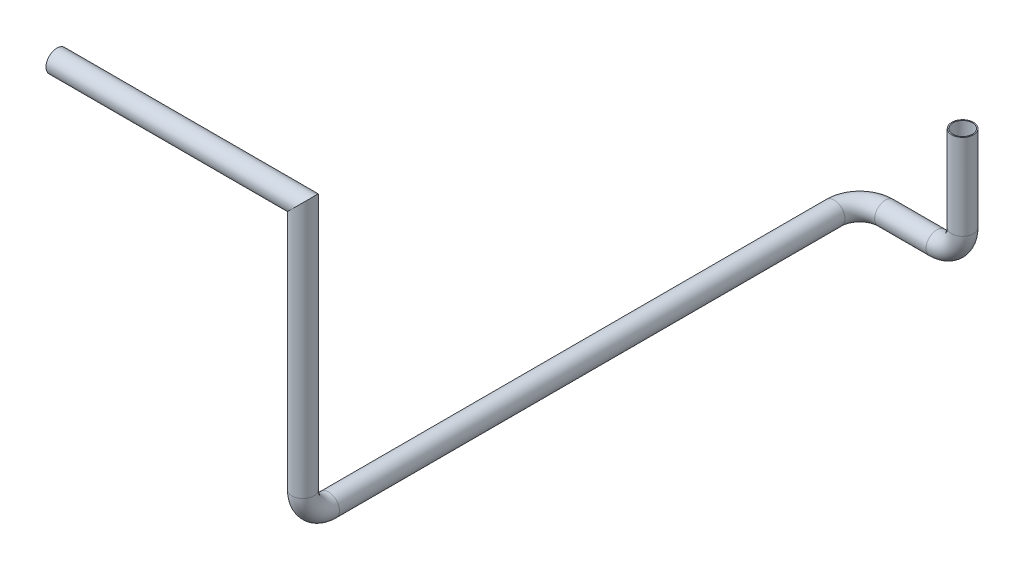
from build123d import *

# Parameters (mm, degrees)
CROQUIS1_R              = 12.7
CROQUIS1_R_2            = 11.5
SALIENTE_EXTRUIR1_DEPTH = 10
CROQUIS2_R              = 12.7
CROQUIS2_R_2            = 11.5


with BuildPart() as part:
    # Croquis1 → Saliente-Extruir1 (new body)
    with BuildSketch(Plane(origin=(0, 0, 0), x_dir=(1, 0, 0), z_dir=(0, 1, 0))):
        with Locations(Location((0, 0, 0), (0, 0, 270))):
            Circle(CROQUIS1_R)
        with Locations(Location((0, 0, 0), (0, 0, 270))):
            Circle(CROQUIS1_R_2, mode=Mode.SUBTRACT)
    extrude(amount=-SALIENTE_EXTRUIR1_DEPTH)

    # Barrer1: sweep along a curve in space
    with BuildLine() as barrer1_path:
        Line((0, -10, 0), (0, -100, 0))
        ThreePointArc((0, -100, 0), (-8.786796564, -121.213203436, 0), (-30, -130, 0))
        Line((-30, -130, 0), (-90, -130, 0))
        ThreePointArc((-90, -130, 0), (-111.213203436, -130, 8.786796564), (-120, -130, 30))
        Line((-120, -130, 30), (-120, -130, 620))
        ThreePointArc((-120, -130, 620), (-120, -121.213203436, 641.213203436), (-120, -100, 650))
        Line((-120, -100, 650), (-120, 190, 650))
        Line((-120, 190, 650), (-407.11382464, 190, 650))
    # Croquis2 → Barrer1 (sweep)
    with BuildSketch(Plane.XZ.offset(10)):
        Circle(CROQUIS2_R)
        Circle(CROQUIS2_R_2, mode=Mode.SUBTRACT)
    sweep(path=barrer1_path.line, transition=Transition.RIGHT)


solid = part.part
